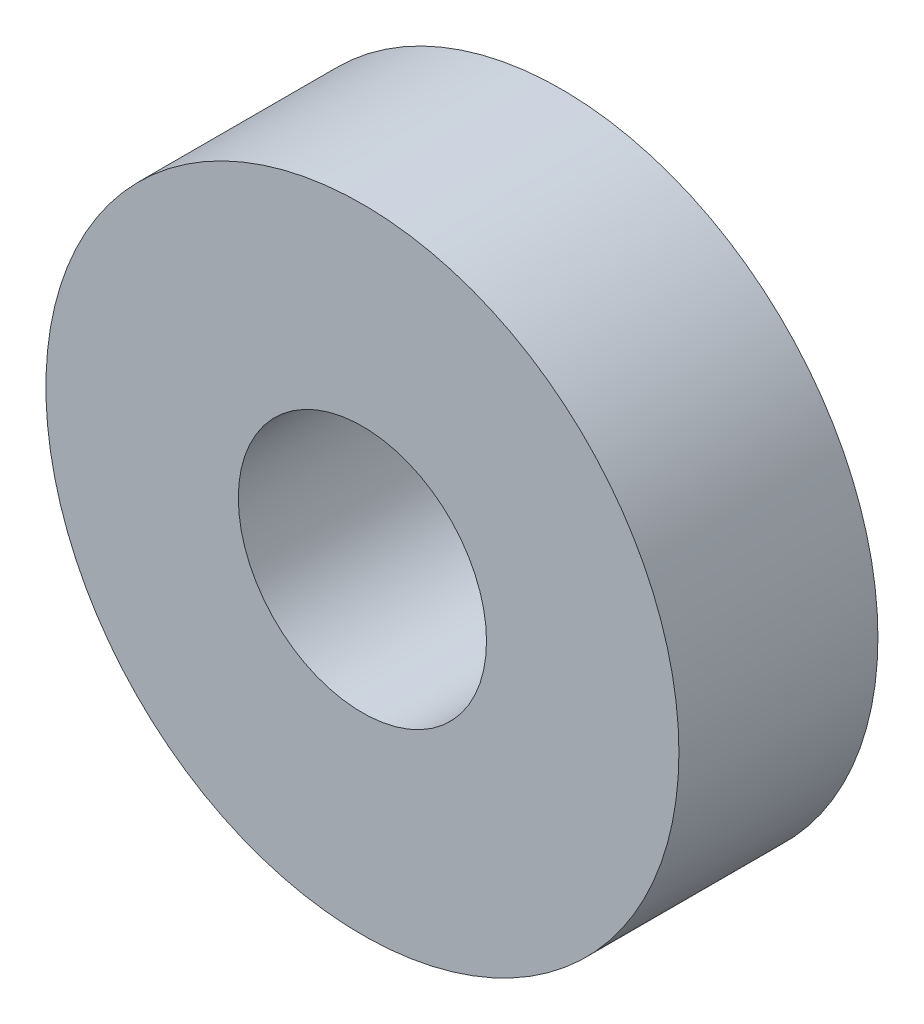
from build123d import *

# Parameters (mm, degrees)
ESQUISSE1_R        = 10.1
ESQUISSE1_R_2      = 3.96
BOSS_EXTRU_1_DEPTH = 6.35


with BuildPart() as part:
    # Esquisse1 → Boss.-Extru.1 (new body)
    with BuildSketch(Plane.XY):
        Circle(ESQUISSE1_R)
        Circle(ESQUISSE1_R_2, mode=Mode.SUBTRACT)
    extrude(amount=BOSS_EXTRU_1_DEPTH)


solid = part.part
